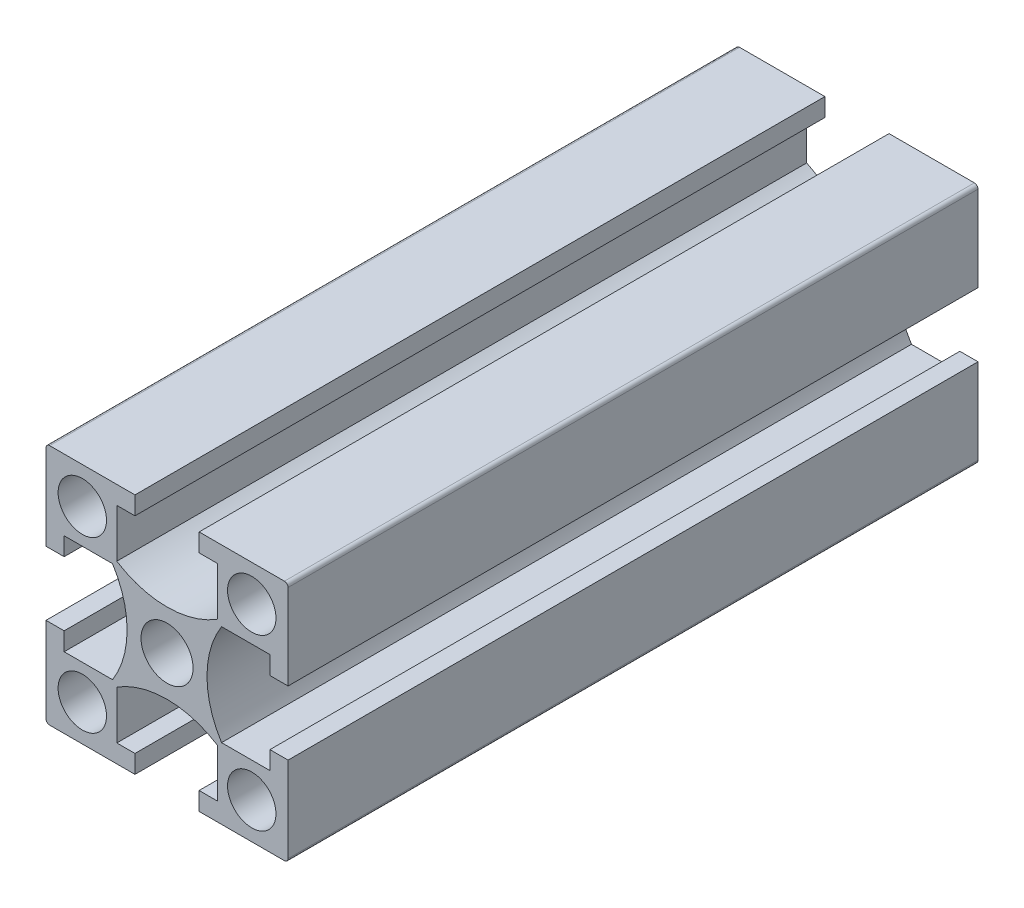
from build123d import *

# Parameters (mm, degrees)
SKETCH_1_W               = 20
SKETCH_1_H               = 20
SKETCH_1_R               = 2
SKETCH_1_R_2             = 2.15
EXTRUDE_1_DEPTH          = 57
CUT_EXTRUDE_1_REACH      = 60.728
PATTERN_CIRCULAR_1_COUNT = 4
FILLET_1_R               = 0.3
CUT_EXTRUDE_2_DEPTH      = 59.72818744
CUT_EXTRUDE_2_DEPTH_BACK = 59.72818744
SKETCH_2_R               = 2.5
SKETCH_3_R               = 2.5
CUT_EXTRUDE_3_DEPTH      = 62.229078152
SKETCH_4_R               = 2.5
CUT_EXTRUDE_4_DEPTH      = 62.229078152


with BuildPart() as part:
    # 스케치1 → 보스-돌출1 (new body)
    with BuildSketch(Plane.XY):
        Rectangle(SKETCH_1_W, SKETCH_1_H)
        with Locations((-7, -7)):
            Circle(SKETCH_1_R, mode=Mode.SUBTRACT)
        with Locations((7, -7)):
            Circle(SKETCH_1_R, mode=Mode.SUBTRACT)
        with Locations((-7, 7)):
            Circle(SKETCH_1_R, mode=Mode.SUBTRACT)
        Circle(SKETCH_1_R_2, mode=Mode.SUBTRACT)
        with Locations((7, 7)):
            Circle(SKETCH_1_R, mode=Mode.SUBTRACT)
    extrude(amount=EXTRUDE_1_DEPTH)

    # 스케치1<3> → 컷-돌출1 (cut, up to next)
    with BuildSketch(Plane.XY, mode=Mode.PRIVATE) as cut_extrude_1_sk1:
        with BuildLine():
            Line((-8.5, 2.65), (-10, 2.65))
            Line((-10, 2.65), (-10, -2.65))
            Line((-10, -2.65), (-8.5, -2.65))
            Line((-8.5, -2.65), (-8.5, -4.15))
            Line((-8.5, -4.15), (-4.503166667, -4.15))
            ThreePointArc((-4.503166667, -4.15), (-3.3, 0), (-4.503166667, 4.15))
            Line((-4.503166667, 4.15), (-8.5, 4.15))
            Line((-8.5, 4.15), (-8.5, 2.65))
        make_face()
    cut_extrude_1_tool1 = extrude(cut_extrude_1_sk1.sketch, amount=CUT_EXTRUDE_1_REACH, mode=Mode.PRIVATE) & part.part
    cut_extrude_1 = cut_extrude_1_tool1.solids().sort_by_distance((-6.606913, 0, 0))[0]
    add(cut_extrude_1, mode=Mode.SUBTRACT)

    # 원형 패턴1: 컷-돌출1 ×4 about axis
    pattern_circular_1_axis = Axis((0, 0, 57), (0, 0, -1))
    for i in range(1, PATTERN_CIRCULAR_1_COUNT):
        add(cut_extrude_1.rotate(pattern_circular_1_axis, i * 360 / PATTERN_CIRCULAR_1_COUNT), mode=Mode.SUBTRACT)

    # 필렛1
    fillet_1_edges = [part.edges().sort_by_distance(p)[0] for p in [
        (10, -10, 28.5),
        (-10, -10, 28.5),
        (-10, 10, 28.5),
        (10, 10, 28.5),
    ]]
    fillet(fillet_1_edges, radius=FILLET_1_R)

    # 스케치2 → 컷-돌출2 (cut, two sides: drawn at the far end of the back side and taken through both)
    with BuildSketch(Plane(origin=(0, 0, 0), x_dir=(0, 0, -1), z_dir=(1, 0, 0)).offset(-CUT_EXTRUDE_2_DEPTH_BACK)):
        with Locations((-19, 0)):
            Circle(SKETCH_2_R)
    extrude(amount=CUT_EXTRUDE_2_DEPTH + CUT_EXTRUDE_2_DEPTH_BACK, mode=Mode.SUBTRACT)

    # 스케치3 → 컷-돌출3 (cut, through all)
    with BuildSketch(Plane(origin=(10, 0, 0), x_dir=(0, 0, -1), z_dir=(1, 0, 0))):
        with Locations((-11, 0)):
            Circle(SKETCH_3_R)
    extrude(amount=-CUT_EXTRUDE_3_DEPTH, mode=Mode.SUBTRACT)

    # 스케치4 → 컷-돌출4 (cut, through all)
    with BuildSketch(Plane(origin=(0, 10, 0), x_dir=(1, 0, 0), z_dir=(0, 1, 0))):
        with Locations((0, -48)):
            Circle(SKETCH_4_R)
    extrude(amount=-CUT_EXTRUDE_4_DEPTH, mode=Mode.SUBTRACT)


solid = part.part
